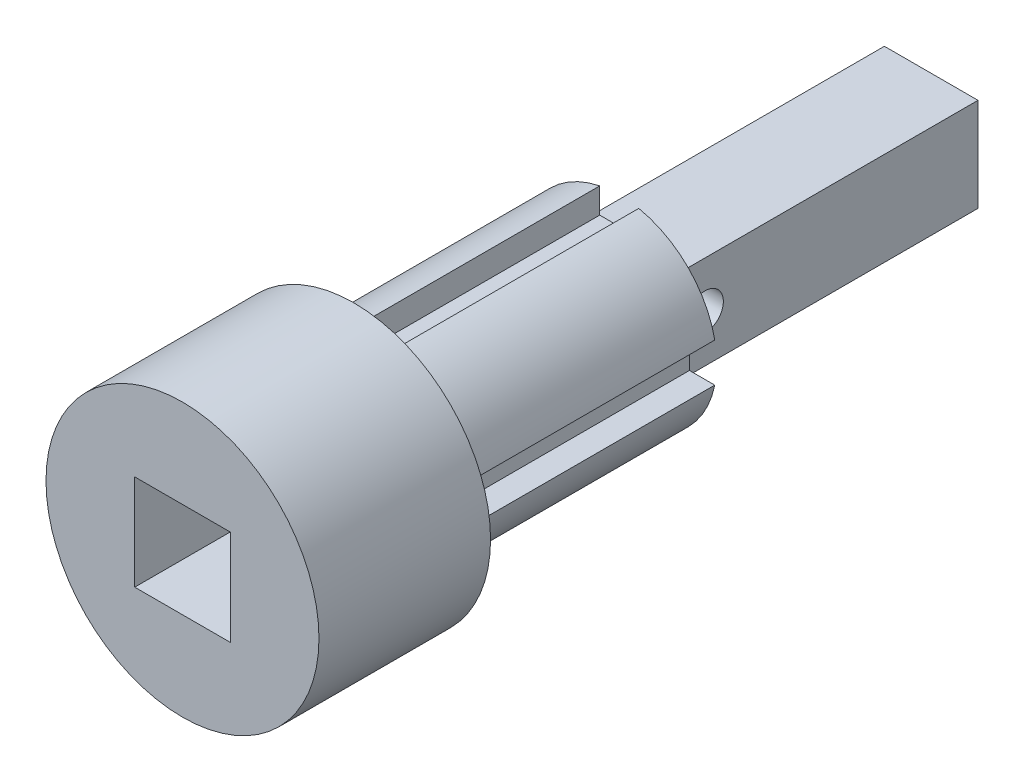
from build123d import *

# Parameters (mm, degrees)
ESBO_O1_R                  = 17.5
RESSALTO_EXTRUS_O1_DEPTH   = 22
ESBO_O2_W                  = 12.25
ESBO_O2_H                  = 12.25
CORTE_EXTRUS_O1_DEPTH      = 25
ESBO_O3_R                  = 12.5
RESSALTO_EXTRUS_O2_DEPTH   = 34
ESBO_O4_W                  = 5
ESBO_O4_H                  = 6
ESBO_O4_W_2                = 6
ESBO_O4_H_2                = 5
CORTE_EXTRUS_O2_DEPTH      = 32
FILETE2_R                  = 2
FILETE3_R                  = 2
FILETE4_R                  = 2
FILETE5_R                  = 2
ESBO_O5_W                  = 12
ESBO_O5_H                  = 12
RESSALTO_EXTRUS_O3_DEPTH   = 40
CORTE_EXTRUS_O3_DEPTH      = 14
CORTE_EXTRUS_O3_DEPTH_BACK = 15
ESBO_O6_R                  = 2.35


with BuildPart() as part:
    # Esboço1 → Ressalto-extrusão1 (new body)
    with BuildSketch(Plane.XY):
        Circle(ESBO_O1_R)
    extrude(amount=RESSALTO_EXTRUS_O1_DEPTH)

    # Esboço2 → Corte-extrusão1 (cut)
    with BuildSketch(Plane(origin=(0, 0, 0), x_dir=(-1, 0, 0), z_dir=(0, 0, -1))):
        Rectangle(ESBO_O2_W, ESBO_O2_H)
    extrude(amount=-CORTE_EXTRUS_O1_DEPTH, mode=Mode.SUBTRACT)

    # Esboço3 → Ressalto-extrusão2 (add)
    with BuildSketch(Plane(origin=(0, 0, 0), x_dir=(-1, 0, 0), z_dir=(0, 0, -1))):
        with Locations(Location((0, 0, 0), (0, 0, 180))):
            Circle(ESBO_O3_R)
    extrude(amount=RESSALTO_EXTRUS_O2_DEPTH)

    # Esboço4 → Corte-extrusão2 (cut)
    with BuildSketch(Plane(origin=(0, 0, -34), x_dir=(-1, 0, 0), z_dir=(0, 0, -1))):
        with Locations((0, -12)):
            Rectangle(ESBO_O4_W, ESBO_O4_H)
        with Locations((0, 12)):
            Rectangle(ESBO_O4_W, ESBO_O4_H)
        with Locations((12, 0)):
            Rectangle(ESBO_O4_W_2, ESBO_O4_H_2)
        with Locations((-12, 0)):
            Rectangle(ESBO_O4_W_2, ESBO_O4_H_2)
    extrude(amount=-CORTE_EXTRUS_O2_DEPTH, mode=Mode.SUBTRACT)

    # Filete2
    filete2_edges = [part.edges().sort_by_distance(p)[0] for p in [
        (10.623724357, 2.5, -2),
        (10.623724357, -2.5, -2),
        (9, 0, -2),
    ]]
    fillet(filete2_edges, radius=FILETE2_R)

    # Filete3
    filete3_edges = [part.edges().sort_by_distance(p)[0] for p in [
        (2.5, -10.623724357, -2),
        (-2.5, -10.623724357, -2),
        (0, -9, -2),
    ]]
    fillet(filete3_edges, radius=FILETE3_R)

    # Filete4
    filete4_edges = [part.edges().sort_by_distance(p)[0] for p in [
        (-10.623724357, 2.5, -2),
        (-10.623724357, -2.5, -2),
        (-9, 0, -2),
    ]]
    fillet(filete4_edges, radius=FILETE4_R)

    # Filete5
    filete5_edges = [part.edges().sort_by_distance(p)[0] for p in [
        (2.5, 10.623724357, -2),
        (-2.5, 10.623724357, -2),
        (0, 9, -2),
    ]]
    fillet(filete5_edges, radius=FILETE5_R)

    # Esboço5 → Ressalto-extrusão3 (add)
    with BuildSketch(Plane(origin=(0, 0, -34), x_dir=(-1, 0, 0), z_dir=(0, 0, -1))):
        Rectangle(ESBO_O5_W, ESBO_O5_H)
    extrude(amount=RESSALTO_EXTRUS_O3_DEPTH)

    # Esboço6 → Corte-extrusão3 (cut, two sides: drawn at the far end of the back side and taken through both)
    with BuildSketch(Plane(origin=(6, 0, 0), x_dir=(0, 0, -1), z_dir=(1, 0, 0)).offset(-CORTE_EXTRUS_O3_DEPTH_BACK)):
        with Locations(Location((39, 0, 0), (0, 0, 270))):
            Circle(ESBO_O6_R)
    extrude(amount=CORTE_EXTRUS_O3_DEPTH + CORTE_EXTRUS_O3_DEPTH_BACK, mode=Mode.SUBTRACT)


solid = part.part
